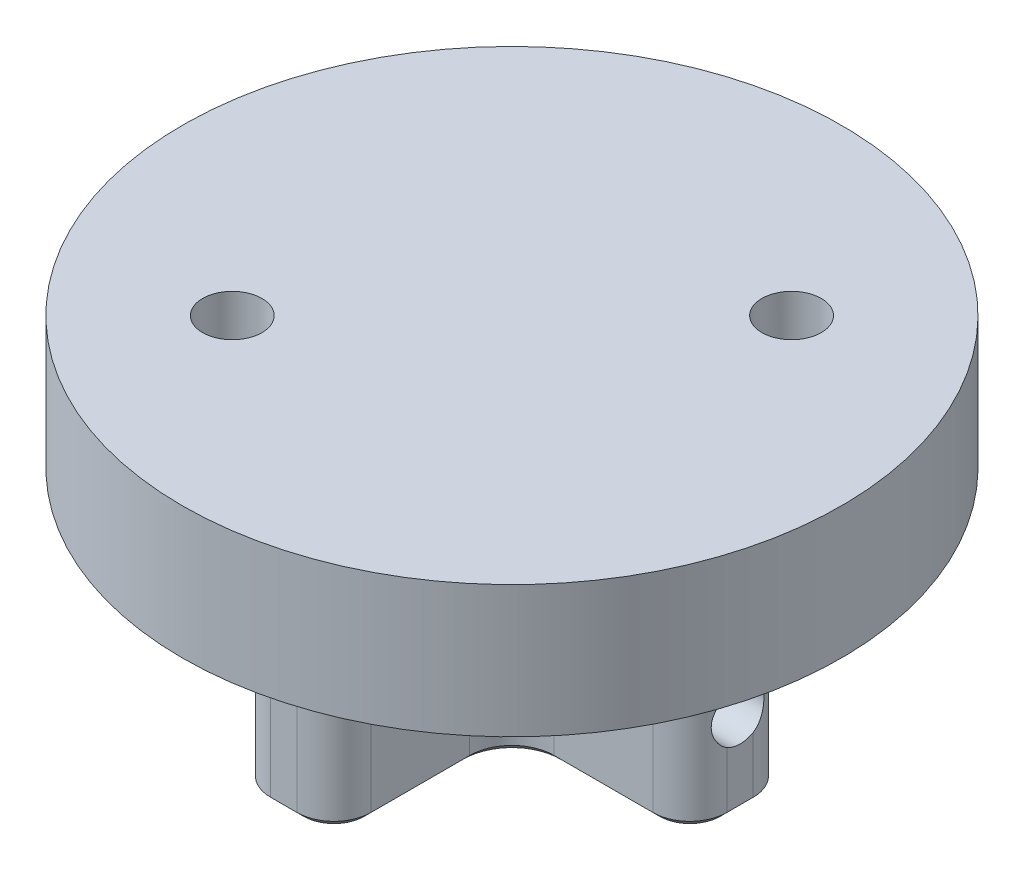
from build123d import *

# Parameters (mm, degrees)
SKETCH1_R                                    = 25
BOSS_EXTRUDE1_DEPTH                          = 25
BOSS_EXTRUDE2_DEPTH                          = 14
SKETCH3_R                                    = 2
CUT_EXTRUDE1_DEPTH                           = 56.129756031
CHAMFER1_SIZE                                = 0.5
CUT_EXTRUDE3_DEPTH                           = 15
CBORE_FOR_M4_HEX_SOCKET_HEAD_CAP_SCR_2_COUNT = 2
CBORE_FOR_M4_HEX_SOCKET_HEAD_CAP_SCR_2_PITCH = 30
CUT_EXTRUDE4_START                           = -15
CUT_EXTRUDE4_DEPTH                           = 15


with BuildPart() as part:
    # Sketch1 → Boss-Extrude1 (new body)
    with BuildSketch(Plane(origin=(0, 0, 0), x_dir=(1, 0, 0), z_dir=(0, 1, 0))):
        with Locations(Location((0, 0, 0), (0, 0, 270))):
            Circle(SKETCH1_R)
    extrude(amount=BOSS_EXTRUDE1_DEPTH)

    # Sketch2 → Boss-Extrude2 (add)
    with BuildSketch(Plane.XZ):
        with BuildLine():
            Line((-17.3, 1), (-17.3, -1))
            ThreePointArc((-17.3, -1), (-16.479898987, -2.979898987), (-14.5, -3.8))
            Line((-14.5, -3.8), (-7, -3.8))
            ThreePointArc((-7, -3.8), (-4.7372583, -4.7372583), (-3.8, -7))
            Line((-3.8, -7), (-3.8, -14.5))
            ThreePointArc((-3.8, -14.5), (-2.979898987, -16.479898987), (-1, -17.3))
            Line((-1, -17.3), (1, -17.3))
            ThreePointArc((1, -17.3), (2.979898987, -16.479898987), (3.8, -14.5))
            Line((3.8, -14.5), (3.8, -7))
            ThreePointArc((3.8, -7), (4.7372583, -4.7372583), (7, -3.8))
            Line((7, -3.8), (14.5, -3.8))
            ThreePointArc((14.5, -3.8), (16.479898987, -2.979898987), (17.3, -1))
            Line((17.3, -1), (17.3, 1))
            ThreePointArc((17.3, 1), (16.479898987, 2.979898987), (14.5, 3.8))
            Line((14.5, 3.8), (7, 3.8))
            ThreePointArc((7, 3.8), (4.7372583, 4.7372583), (3.8, 7))
            Line((3.8, 7), (3.8, 14.5))
            ThreePointArc((3.8, 14.5), (2.979898987, 16.479898987), (1, 17.3))
            Line((1, 17.3), (-1, 17.3))
            ThreePointArc((-1, 17.3), (-2.979898987, 16.479898987), (-3.8, 14.5))
            Line((-3.8, 14.5), (-3.8, 7))
            ThreePointArc((-3.8, 7), (-4.7372583, 4.7372583), (-7, 3.8))
            Line((-7, 3.8), (-14.5, 3.8))
            ThreePointArc((-14.5, 3.8), (-16.479898987, 2.979898987), (-17.3, 1))
        make_face()
    extrude(amount=BOSS_EXTRUDE2_DEPTH)

    # Sketch3 → Cut-Extrude1 (cut, through all)
    with BuildSketch(Plane.ZY.offset(17.3)):
        with Locations(Location((0, -7.5, 0), (0, 0, 60))):
            Circle(SKETCH3_R)
    extrude(amount=-CUT_EXTRUDE1_DEPTH, mode=Mode.SUBTRACT)

    # Chamfer1
    chamfer1_edges = [part.edges().sort_by_distance(p)[0] for p in [
        (-16.479898987, -14, -2.979898987),
        (-10.75, -14, -3.8),
        (-4.7372583, -14, -4.7372583),
        (-3.8, -14, -10.75),
        (-2.979898987, -14, -16.479898987),
        (0, -14, -17.3),
        (2.979898987, -14, -16.479898987),
        (3.8, -14, -10.75),
        (4.7372583, -14, -4.7372583),
        (10.75, -14, -3.8),
        (16.479898987, -14, -2.979898987),
        (17.3, -14, 0),
        (16.479898987, -14, 2.979898987),
        (10.75, -14, 3.8),
        (4.7372583, -14, 4.7372583),
        (3.8, -14, 10.75),
        (2.979898987, -14, 16.479898987),
        (0, -14, 17.3),
        (-2.979898987, -14, 16.479898987),
        (-3.8, -14, 10.75),
        (-4.7372583, -14, 4.7372583),
        (-10.75, -14, 3.8),
        (-16.479898987, -14, 2.979898987),
        (-17.3, -14, 0),
    ]]
    chamfer(chamfer1_edges, length=CHAMFER1_SIZE)

    # Sketch7 → Cut-Extrude3 (cut)
    with BuildSketch(Plane(origin=(0, 25, 0), x_dir=(1, 0, 0), z_dir=(0, 1, 0))):
        with BuildLine():
            Line((-25.358862505, -19.065612153), (19.065612153, 25.358862505))
            ThreePointArc((19.065612153, 25.358862505), (25.358862505, 25.358862505), (25.358862505, 19.065612153))
            Line((25.358862505, 19.065612153), (-19.065612153, -25.358862505))
            ThreePointArc((-19.065612153, -25.358862505), (-25.358862505, -25.358862505), (-25.358862505, -19.065612153))
        make_face()
    extrude(amount=-CUT_EXTRUDE3_DEPTH, mode=Mode.SUBTRACT)

    # Sketch6 → CBORE for M4 Hex Socket Head Cap Screw1 (revolve, cut)
    with BuildSketch(Plane(origin=(10.606601718, 0, -10.606601718), x_dir=(0, 0, -1), z_dir=(1, 0, 0))):
        Polygon((0, 0), (0, 14.351936393), (2.25, 13), (2.25, 4.4), (4, 4.4), (4, 0.025), (4.025, 0), align=None)
    cbore_for_m4_hex_socket_head_cap_screw1 = revolve(axis=Axis((10.606601718, -6.35, -10.606601718), (0, 1, 0)), mode=Mode.SUBTRACT)

    # CBORE for M4 Hex Socket Head Cap Scr 2: CBORE for M4 Hex Socket Head Cap Screw1 ×2
    with Locations(*[Vector(-0.707106781186549, 0, 0.7071067811865461) * (i * CBORE_FOR_M4_HEX_SOCKET_HEAD_CAP_SCR_2_PITCH) for i in range(1, CBORE_FOR_M4_HEX_SOCKET_HEAD_CAP_SCR_2_COUNT)]):
        add(cbore_for_m4_hex_socket_head_cap_screw1, mode=Mode.SUBTRACT)

    # Sketch8 → Cut-Extrude4 (cut)
    with BuildSketch(Plane(origin=(0, 25, 0), x_dir=(1, 0, 0), z_dir=(0, 1, 0)).offset(CUT_EXTRUDE4_START)):
        with BuildLine():
            Line((20.541990938, 14.248740586), (-14.248740586, -20.541990938))
            ThreePointArc((-14.248740586, -20.541990938), (17.67766953, -17.67766953), (20.541990938, 14.248740586))
        make_face()
        with BuildLine():
            Line((-20.541990938, -14.248740586), (14.248740586, 20.541990938))
            ThreePointArc((14.248740586, 20.541990938), (-17.67766953, 17.67766953), (-20.541990938, -14.248740586))
        make_face()
    extrude(amount=CUT_EXTRUDE4_DEPTH, mode=Mode.SUBTRACT)


solid = part.part
